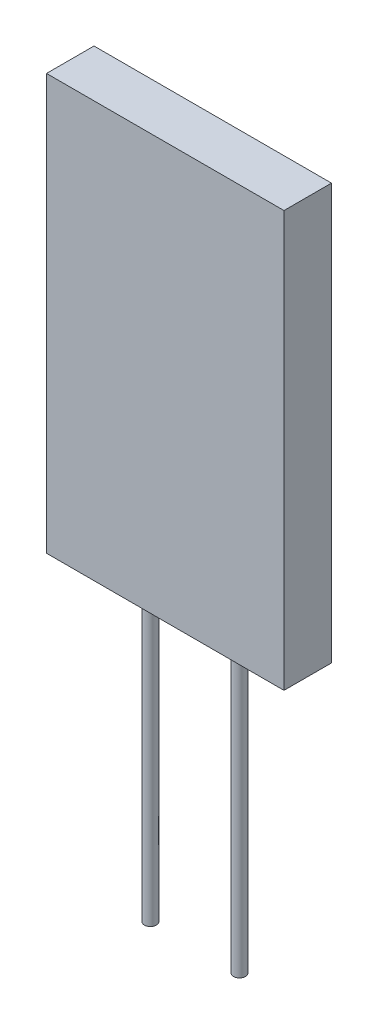
from build123d import *

# Parameters (mm, degrees)
SKETCH_1_W          = 4
SKETCH_1_H          = 7
EXTRUDE_1_DEPTH     = 1
SKETCH_2_W          = 0.5
SKETCH_2_H          = 7
CUT_EXTRUDE_2_DEPTH = 0.2
SKETCH_3_W          = 4
SKETCH_3_H          = 0.454516336
SKETCH_3_H_2        = 0.454516335
CUT_EXTRUDE_4_DEPTH = 0.2
SWEEP_1_PROFILE_R   = 0.1
SWEEP_2_PROFILE_R   = 0.1


with BuildPart() as part:
    # 草图1 → 凸台-拉伸1 (new body)
    with BuildSketch(Plane.XY):
        Rectangle(SKETCH_1_W, SKETCH_1_H)
    extrude(amount=EXTRUDE_1_DEPTH)

    # 草图2 → 切除-拉伸2 (cut)
    with BuildSketch(Plane.XY):
        with Locations((1.75, 0)):
            Rectangle(SKETCH_2_W, SKETCH_2_H)
        with Locations((0.75, 0)):
            Rectangle(SKETCH_2_W, SKETCH_2_H)
        with Locations((-0.25, 0)):
            Rectangle(SKETCH_2_W, SKETCH_2_H)
        with Locations((-1.25, 0)):
            Rectangle(SKETCH_2_W, SKETCH_2_H)
    extrude(amount=CUT_EXTRUDE_2_DEPTH, mode=Mode.SUBTRACT)

    # 草图3 → 切除-拉伸4 (cut)
    with BuildSketch(Plane.XY):
        with Locations((0, 3.272741832)):
            Rectangle(SKETCH_3_W, SKETCH_3_H)
        with Locations((0, 2.363709161)):
            Rectangle(SKETCH_3_W, SKETCH_3_H)
        with Locations((0, 1.45467649)):
            Rectangle(SKETCH_3_W, SKETCH_3_H_2)
        with Locations((0, 0.545643818)):
            Rectangle(SKETCH_3_W, SKETCH_3_H)
        with Locations((0, -0.363388853)):
            Rectangle(SKETCH_3_W, SKETCH_3_H)
        with Locations((0, -1.272421525)):
            Rectangle(SKETCH_3_W, SKETCH_3_H)
        with Locations((0, -2.181454196)):
            Rectangle(SKETCH_3_W, SKETCH_3_H)
        with Locations((0, -3.090486868)):
            Rectangle(SKETCH_3_W, SKETCH_3_H_2)
    extrude(amount=CUT_EXTRUDE_4_DEPTH, mode=Mode.SUBTRACT)

    # 扫描1: sweep along a path in 草图4
    with BuildLine(Plane.XY.offset(0.5)) as sweep_1_path:
        Line((-0.75, -3.5), (-0.75, -8.5))
    # 扫描1 profile (on start of the path) → 扫描1 (sweep)
    with BuildSketch(Plane(origin=(-0.75, -3.5, 0.5), x_dir=(-1, 0, 0), z_dir=(0, -1, 0))):
        Circle(SWEEP_1_PROFILE_R)
    sweep(path=sweep_1_path.line)

    # 扫描2: sweep along a path in 草图11
    with BuildLine(Plane.XY.offset(0.5)) as sweep_2_path:
        Line((0.75, -3.5), (0.75, -8.5))
    # 扫描2 profile (on start of the path) → 扫描2 (sweep)
    with BuildSketch(Plane(origin=(0.75, -3.5, 0.5), x_dir=(-1, 0, 0), z_dir=(0, -1, 0))):
        Circle(SWEEP_2_PROFILE_R)
    sweep(path=sweep_2_path.line)


solid = part.part
